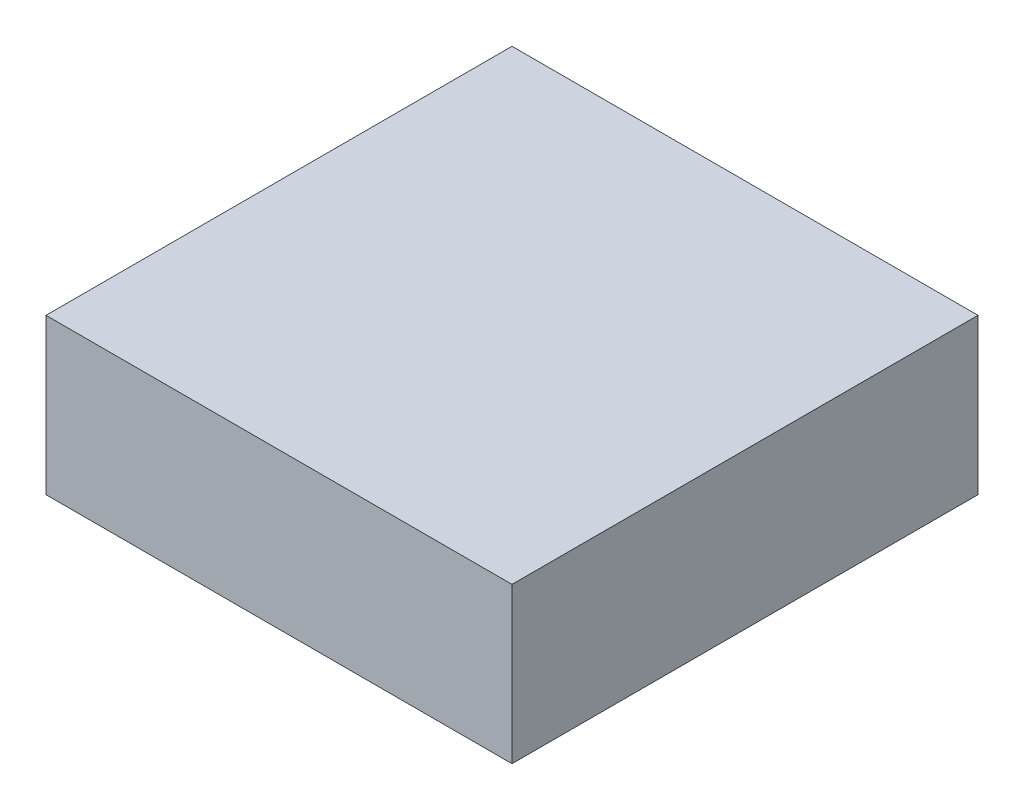
from build123d import *

# Parameters (mm, degrees)
SKETCH1_W           = 12.6
SKETCH1_H           = 12.6
BOSS_EXTRUDE1_DEPTH = 4.2


with BuildPart() as part:
    # Sketch1 → Boss-Extrude1 (new body)
    with BuildSketch(Plane(origin=(0, 0, 0), x_dir=(1, 0, 0), z_dir=(0, 1, 0))):
        Rectangle(SKETCH1_W, SKETCH1_H)
    extrude(amount=BOSS_EXTRUDE1_DEPTH)


solid = part.part
